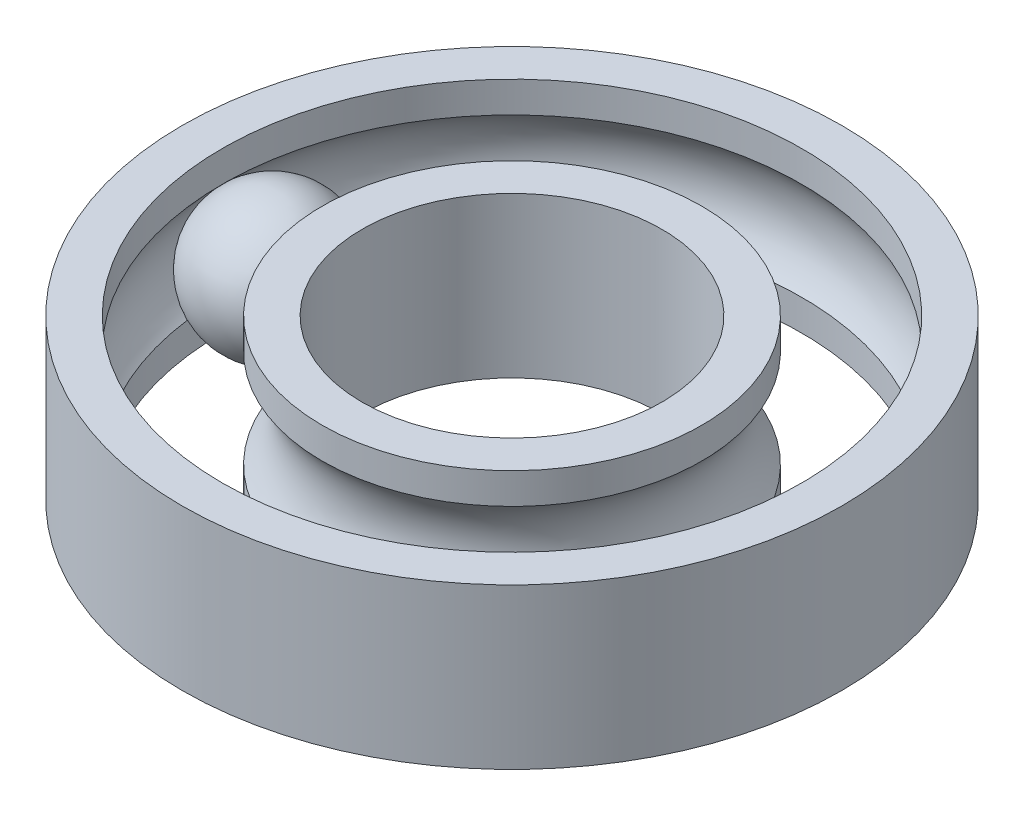
from build123d import *


with BuildPart() as part:
    # Sketch2 → Revolve1 (revolve)
    with BuildSketch(Plane.XY):
        with BuildLine():
            ThreePointArc((-30.48, -8.889999836), (-21.59, 1.64e-07), (-30.48, 8.890000164))
            Line((-30.48, 8.890000164), (-30.48, -8.889999836))
        make_face()
    revolve(axis=Axis((-30.48, 10.589901025, 0), (0, -1, 0)))


with BuildPart() as body_2:
    # Sketch1 → Revolve2 (revolve)
    with BuildSketch(Plane.XY, mode=Mode.PRIVATE) as revolve2_sk:
        with BuildLine():
            Line((-41.91, -10.159999672), (-36.83, -10.159999672))
            Line((-36.83, -10.159999672), (-36.83, -6.221703783))
            ThreePointArc((-36.83, -6.221703783), (-39.37, 1.64e-07), (-36.83, 6.221704111))
            Line((-36.83, 6.221704111), (-36.83, 10.160000328))
            Line((-36.83, 10.160000328), (-41.91, 10.160000328))
            Line((-41.91, 10.160000328), (-41.91, -10.159999672))
        make_face()
        with BuildLine():
            Line((-19.05, -10.16), (-24.13, -10.16))
            Line((-24.13, -10.16), (-24.13, -6.221703783))
            ThreePointArc((-24.13, -6.221703783), (-21.59, 1.64e-07), (-24.13, 6.221704111))
            Line((-24.13, 6.221704111), (-24.13, 10.16))
            Line((-24.13, 10.16), (-19.05, 10.16))
            Line((-19.05, 10.16), (-19.05, -10.16))
        make_face()
    revolve(revolve2_sk.sketch.rotate(Axis((0, 11.176000344, 0), (0, -1, 0)), 270), axis=Axis((0, 11.176000344, 0), (0, -1, 0)))


solid = Compound([part.part, body_2.part])
